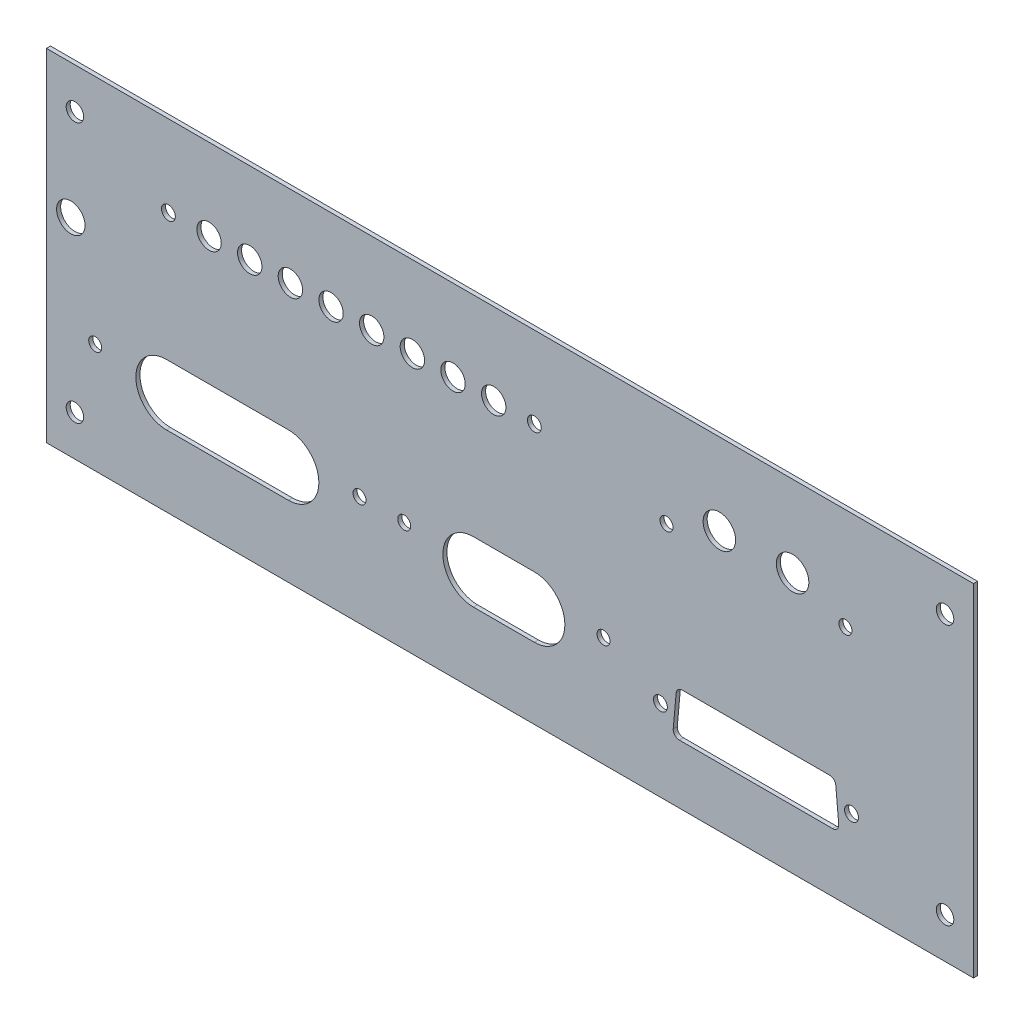
from build123d import *

# Parameters (mm, degrees)
SKETCH_1_W          = 228
SKETCH_1_H          = 84
SKETCH_1_R          = 2.15
EXTRUDE_1_DEPTH     = 1
SKETCH_3_R          = 1.7
SKETCH_3_R_2        = 1.6
SKETCH_3_R_3        = 4
CUT_EXTRUDE_1_DEPTH = 10
SKETCH_4_R          = 3.5
SKETCH_4_R_2        = 1.6
CUT_EXTRUDE_2_DEPTH = 1
SKETCH_5_R          = 1.7
SKETCH_5_R_2        = 3
CUT_EXTRUDE_3_DEPTH = 10


with BuildPart() as part:
    # Эскиз1 → Вытянуть1 (new body)
    with BuildSketch(Plane.XY):
        Rectangle(SKETCH_1_W, SKETCH_1_H)
        with Locations((107, 32)):
            Circle(SKETCH_1_R, mode=Mode.SUBTRACT)
        with Locations(Location((-107, 32, 0), (0, 0, 180))):
            Circle(SKETCH_1_R, mode=Mode.SUBTRACT)
        with Locations((-107, -32)):
            Circle(SKETCH_1_R, mode=Mode.SUBTRACT)
        with Locations(Location((107, -32, 0), (0, 0, 180))):
            Circle(SKETCH_1_R, mode=Mode.SUBTRACT)
    extrude(amount=EXTRUDE_1_DEPTH)

    # Эскиз3 → Вырез-Вытянуть1 (cut)
    with BuildSketch(Plane.XY.offset(1)):
        with Locations((37, -22)):
            Circle(SKETCH_3_R)
        with Locations((84, -22)):
            Circle(SKETCH_3_R)
        with Locations((38.5, 17)):
            Circle(SKETCH_3_R_2)
        with Locations((82.5, 17)):
            Circle(SKETCH_3_R_2)
        with Locations((51.5, 22)):
            Circle(SKETCH_3_R_3)
        with Locations((69.5, 22)):
            Circle(SKETCH_3_R_3)
        with BuildLine():
            Line((40.14870942, -25.864196381), (40.875982147, -17.864196381))
            ThreePointArc((40.875982147, -17.864196381), (41.358314525, -16.892366164), (42.369821957, -16.5))
            Line((42.369821957, -16.5), (78.630178043, -16.5))
            ThreePointArc((78.630178043, -16.5), (79.641685475, -16.892366164), (80.124017853, -17.864196381))
            Line((80.124017853, -17.864196381), (80.85129058, -25.864196381))
            ThreePointArc((80.85129058, -25.864196381), (80.465084606, -27.011507432), (79.35745077, -27.5))
            Line((79.35745077, -27.5), (41.64254923, -27.5))
            ThreePointArc((41.64254923, -27.5), (40.534915394, -27.011507432), (40.14870942, -25.864196381))
        make_face()
    extrude(amount=-CUT_EXTRUDE_1_DEPTH, mode=Mode.SUBTRACT)

    # Эскиз4 → Вырез-Вытянуть2 (cut)
    with BuildSketch(Plane.XY.offset(1)):
        with Locations((-108, 9)):
            Circle(SKETCH_4_R)
        with Locations((-102, -15)):
            Circle(SKETCH_4_R_2)
        with Locations((-37, -15)):
            Circle(SKETCH_4_R_2)
        with Locations((-26, -15)):
            Circle(SKETCH_4_R_2)
        with Locations((23, -15)):
            Circle(SKETCH_4_R_2)
        with BuildLine():
            Line((-84.5, -9.5), (-54.5, -9.5))
            ThreePointArc((-54.5, -9.5), (-47, -17), (-54.5, -24.5))
            Line((-54.5, -24.5), (-84.5, -24.5))
            ThreePointArc((-84.5, -24.5), (-92, -17), (-84.5, -9.5))
        make_face()
        with BuildLine():
            Line((-9, -9.5), (6, -9.5))
            ThreePointArc((6, -9.5), (13.5, -17), (6, -24.5))
            Line((6, -24.5), (-9, -24.5))
            ThreePointArc((-9, -24.5), (-16.5, -17), (-9, -9.5))
        make_face()
    extrude(amount=-CUT_EXTRUDE_2_DEPTH, mode=Mode.SUBTRACT)

    # Эскиз5 → Вырез-Вытянуть3 (cut)
    with BuildSketch(Plane.XY.offset(1)):
        with Locations((-84, 22)):
            Circle(SKETCH_5_R)
        with Locations((6, 22)):
            Circle(SKETCH_5_R)
        with Locations((-4, 22)):
            Circle(SKETCH_5_R_2)
        with Locations((-14, 22)):
            Circle(SKETCH_5_R_2)
        with Locations((-24, 22)):
            Circle(SKETCH_5_R_2)
        with Locations((-34, 22)):
            Circle(SKETCH_5_R_2)
        with Locations((-44, 22)):
            Circle(SKETCH_5_R_2)
        with Locations((-54, 22)):
            Circle(SKETCH_5_R_2)
        with Locations((-64, 22)):
            Circle(SKETCH_5_R_2)
        with Locations((-74, 22)):
            Circle(SKETCH_5_R_2)
    extrude(amount=-CUT_EXTRUDE_3_DEPTH, mode=Mode.SUBTRACT)


solid = part.part
